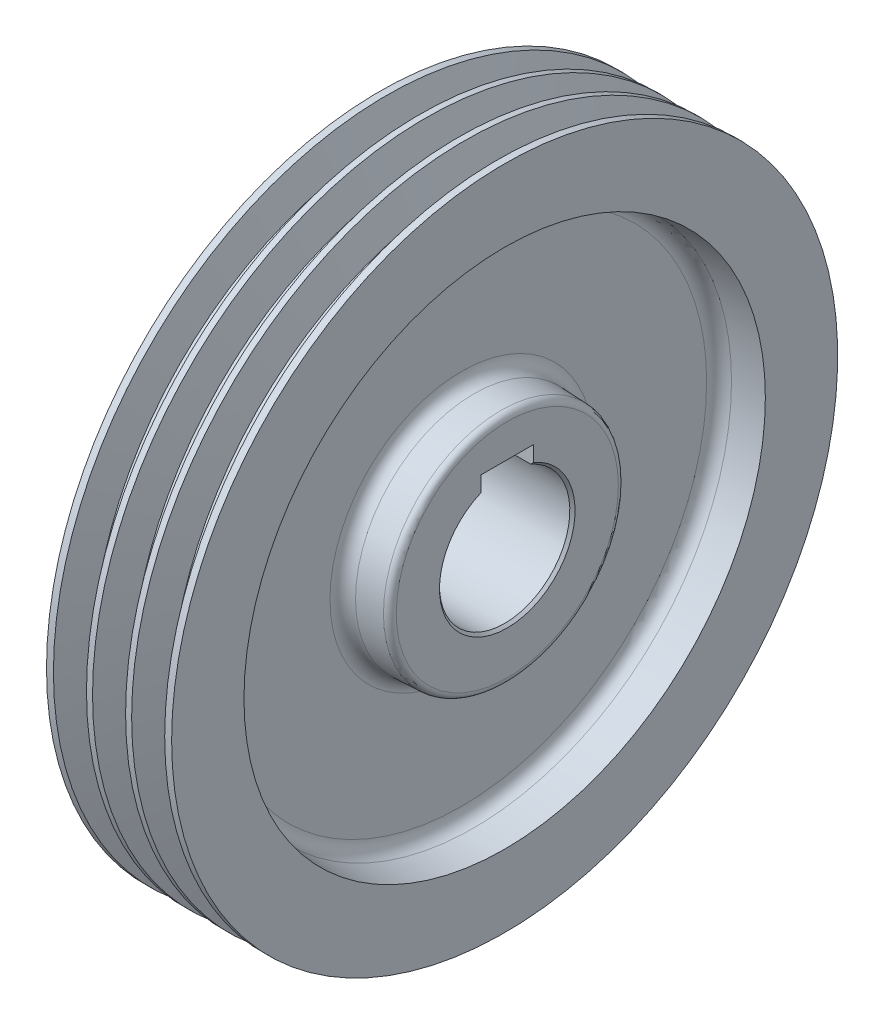
from build123d import *

# Parameters (mm, degrees)
PATTERN_LINEAR_1019_COUNT = 3
PATTERN_LINEAR_1019_PITCH = 15
CHAMFER_1_SIZE            = 1
SKETCH_4_W                = 20
SKETCH_4_H                = 6.987121525
CUT_EXTRUDE_1_DEPTH       = 188.456995068
FILLET_1_R                = 5
FILLET_2_R                = 2.5


with BuildPart() as part:
    # 草图1 → 旋转1 (revolve)
    with BuildSketch(Plane.XY, mode=Mode.PRIVATE) as revolve_1_sk:
        Polygon((-1, 25), (-1, 45), (16.5, 46.531051612), (16.5, 99.340175961), (0, 100), (0, 127.75), (48, 127.75), (48, 100), (31.5, 98.556437052), (31.5, 45.699813375), (49, 45), (49, 25), align=None)
    revolve(revolve_1_sk.sketch.rotate(Axis((0, 0, 0), (1, 0, 0)), 90), axis=Axis((0, 0, 0), (1, 0, 0)))

    # 草图2 → 切除-旋转1 (revolve, cut)
    with BuildSketch(Plane.XY, mode=Mode.PRIVATE) as cut_revolve_1_sk:
        Polygon((11.840143071, 116.3), (15.340759374, 127.75), (2.659240626, 127.75), (6.159856929, 116.3), align=None)
    cut_revolve_1 = revolve(cut_revolve_1_sk.sketch.rotate(Axis((0, 0, 0), (1, 0, 0)), 90), axis=Axis((0, 0, 0), (1, 0, 0)), mode=Mode.SUBTRACT)

    # Pattern Linear 1019: 切除-旋转1 ×3
    with Locations(*[(i * PATTERN_LINEAR_1019_PITCH, 0, 0) for i in range(1, PATTERN_LINEAR_1019_COUNT)]):
        add(cut_revolve_1, mode=Mode.SUBTRACT)

    # 倒角1
    chamfer_1_edges = [part.edges().sort_by_distance(p)[0] for p in [
        (-1, 0, -25),
        (49, 0, -25),
    ]]
    chamfer(chamfer_1_edges, length=CHAMFER_1_SIZE)

    # 草图4 → 切除-拉伸1 (cut, through all)
    with BuildSketch(Plane.ZY.offset(1)):
        with Locations((0, 26.406439238)):
            Rectangle(SKETCH_4_W, SKETCH_4_H)
    extrude(amount=-CUT_EXTRUDE_1_DEPTH, mode=Mode.SUBTRACT)

    # 圆角1
    fillet_1_edges = [part.edges().sort_by_distance(p)[0] for p in [
        (16.5, 0, -99.340175961),
        (16.5, 0, -46.531051612),
        (31.5, 0, -45.699813375),
        (31.5, 0, -98.556437052),
    ]]
    fillet(fillet_1_edges, radius=FILLET_1_R)

    # 圆角2
    fillet_2_edges = [part.edges().sort_by_distance(p)[0] for p in [
        (-1, 0, -45),
        (49, 0, -45),
    ]]
    fillet(fillet_2_edges, radius=FILLET_2_R)


solid = part.part
